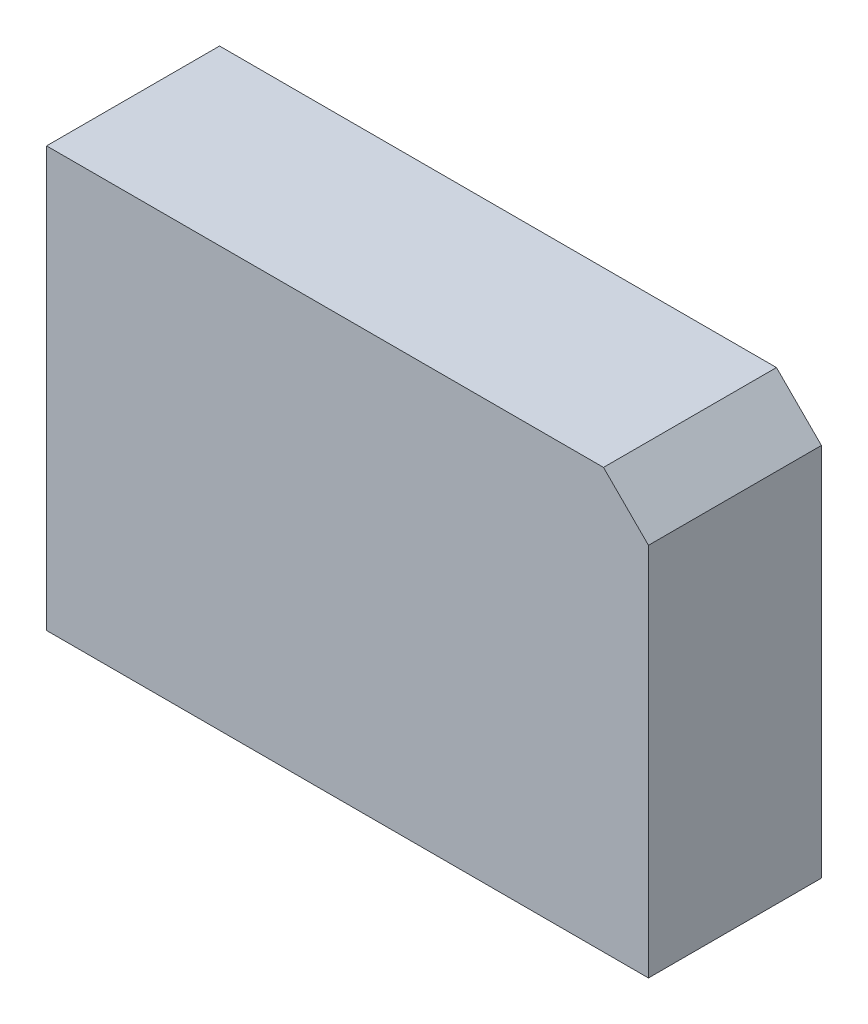
from build123d import *

# Parameters (mm, degrees)
CHAMFERSTOCKSKETCH_W         = 65.25
CHAMFERSTOCKSKETCH_H         = 45.5
CHAMFERSTOCKBOSS_DEPTH       = 18.75
DISTANCEPAIREDGECHAMFER_SIZE = 4.875


with BuildPart() as part:
    # ChamferStockSketch → ChamferStockBoss (new body)
    with BuildSketch(Plane.XY):
        with Locations((11.25, -8.125)):
            Rectangle(CHAMFERSTOCKSKETCH_W, CHAMFERSTOCKSKETCH_H)
    extrude(amount=CHAMFERSTOCKBOSS_DEPTH)

    # DistancePairEdgeChamfer
    distancepairedgechamfer_edges = [part.edges().sort_by_distance(p)[0] for p in [
        (43.875, 14.625, 9.375),
    ]]
    chamfer(distancepairedgechamfer_edges, length=DISTANCEPAIREDGECHAMFER_SIZE)


solid = part.part
